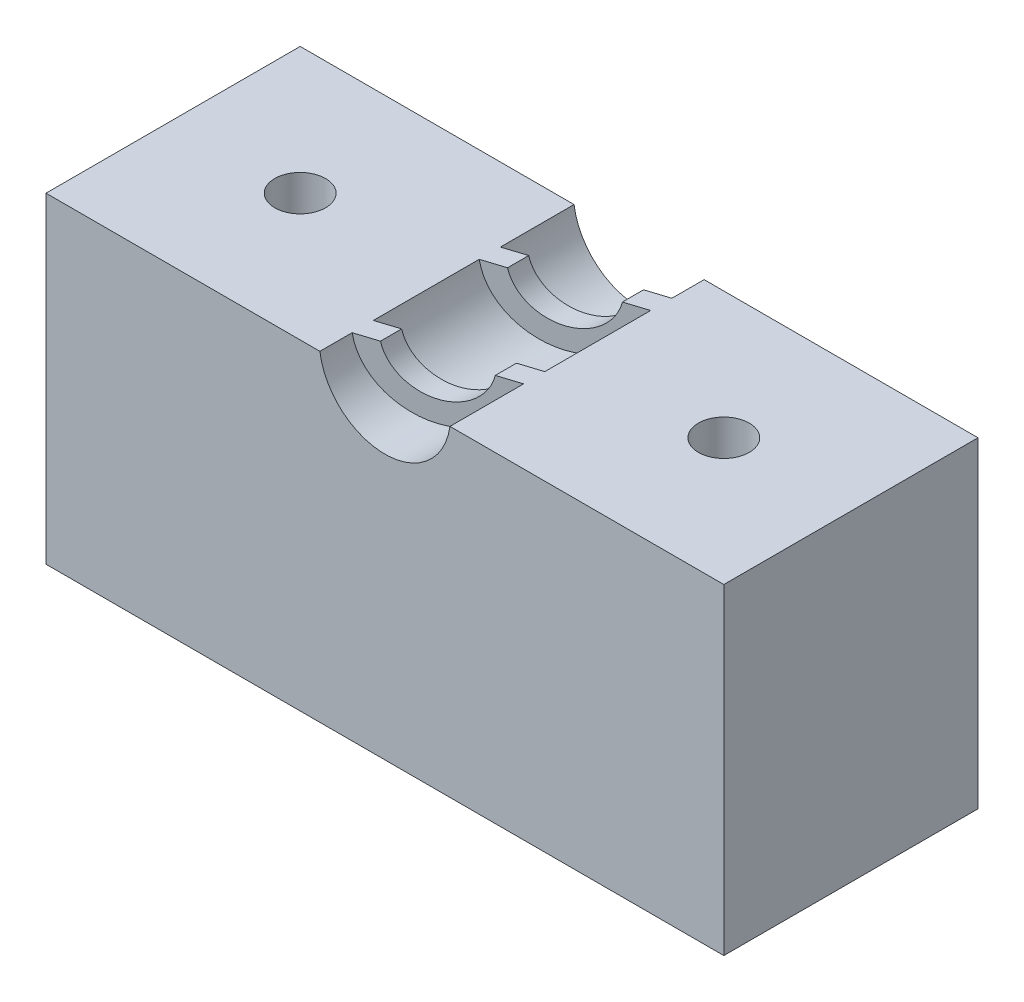
from build123d import *

# Parameters (mm, degrees)
SKETCH_1_W               = 16
SKETCH_1_H               = 16
SKETCH_1_R               = 1.55
EXTRUDE_1_DEPTH          = 3
EXTRUDE_2_DEPTH          = 8
CUT_EXTRUDE_2_DEPTH      = 12.704699911
CUT_EXTRUDE_2_DEPTH_BACK = 12.704699911
SKETCH_8_R               = 0.6
CUT_EXTRUDE_3_DEPTH      = 12.704699911
CUT_EXTRUDE_START        = -0.2
SKETCH_10_W              = 16
SKETCH_10_H              = 6
SKETCH_10_R              = 0.6
CUT_EXTRUDE_7_DEPTH      = 0.2


with BuildPart() as part:
    # 草图1 → 凸台-拉伸1 (new, symmetric)
    with BuildSketch(Plane.XY):
        Rectangle(SKETCH_1_W, SKETCH_1_H)
        Circle(SKETCH_1_R, mode=Mode.SUBTRACT)
    extrude(amount=EXTRUDE_1_DEPTH, both=True)

    # 草图6 → 凸台-拉伸2 (add)
    with BuildSketch(Plane(origin=(0, 0, 0), x_dir=(1, 0, 0), z_dir=(0, 1, 0))):
        Polygon((-1.55, -1.743476048), (-1.55, -2.243476048), (1.55, -1.256523952), (1.55, -0.756523952), align=None)
        Polygon((-1.55, 1.256523952), (-1.55, 0.756523952), (1.55, 1.743476048), (1.55, 2.243476048), align=None)
    extrude(amount=-EXTRUDE_2_DEPTH)

    # 草图7 → 切除-拉伸2 (cut, two sides: drawn at the far end of the back side and taken through both)
    with BuildSketch(Plane.XY.offset(-CUT_EXTRUDE_2_DEPTH_BACK)):
        with BuildLine():
            Line((-8, -0.214092961), (-1.027941732, -0.214092961))
            ThreePointArc((-1.027941732, -0.214092961), (-0.107613153, 1.044470875), (1.05, 0))
            ThreePointArc((1.05, 0), (1.044470875, -0.107613153), (1.027941732, -0.214092961))
            Line((1.027941732, -0.214092961), (8, -0.214092961))
            Line((8, -0.214092961), (8, 8))
            Line((8, 8), (-8, 8))
            Line((-8, 8), (-8, -0.214092961))
        make_face()
        with BuildLine():
            Line((1.027941732, -0.214092961), (0, 0))
            Line((0, 0), (-1.027941732, -0.214092961))
            ThreePointArc((-1.027941732, -0.214092961), (0, -1.05), (1.027941732, -0.214092961))
        make_face()
        with BuildLine():
            Line((-1.027941732, -0.214092961), (0, 0))
            Line((0, 0), (1.027941732, -0.214092961))
            ThreePointArc((1.027941732, -0.214092961), (1.044470875, -0.107613153), (1.05, 0))
            ThreePointArc((1.05, 0), (-0.107613153, 1.044470875), (-1.027941732, -0.214092961))
        make_face()
    extrude(amount=CUT_EXTRUDE_2_DEPTH + CUT_EXTRUDE_2_DEPTH_BACK, mode=Mode.SUBTRACT)

    # 草图8 → 切除-拉伸3 (cut, through all)
    with BuildSketch(Plane(origin=(0, 0, 0), x_dir=(1, 0, 0), z_dir=(0, 1, 0))):
        with Locations(Location((-5, 0, 0), (0, 0, 270))):
            Circle(SKETCH_8_R)
        with Locations(Location((5, 0, 0), (0, 0, 270))):
            Circle(SKETCH_8_R)
    extrude(amount=-CUT_EXTRUDE_3_DEPTH, mode=Mode.SUBTRACT)

    # 草图10 → 切除-拉伸7 (cut)
    with BuildSketch(Plane.XZ.offset(8).offset(CUT_EXTRUDE_START)):
        Rectangle(SKETCH_10_W, SKETCH_10_H)
        with Locations(Location((-5, 0, 0), (0, 0, 180))):
            Circle(SKETCH_10_R, mode=Mode.SUBTRACT)
        with Locations((5, 0)):
            Circle(SKETCH_10_R, mode=Mode.SUBTRACT)
    extrude(amount=CUT_EXTRUDE_7_DEPTH, mode=Mode.SUBTRACT)


solid = part.part
